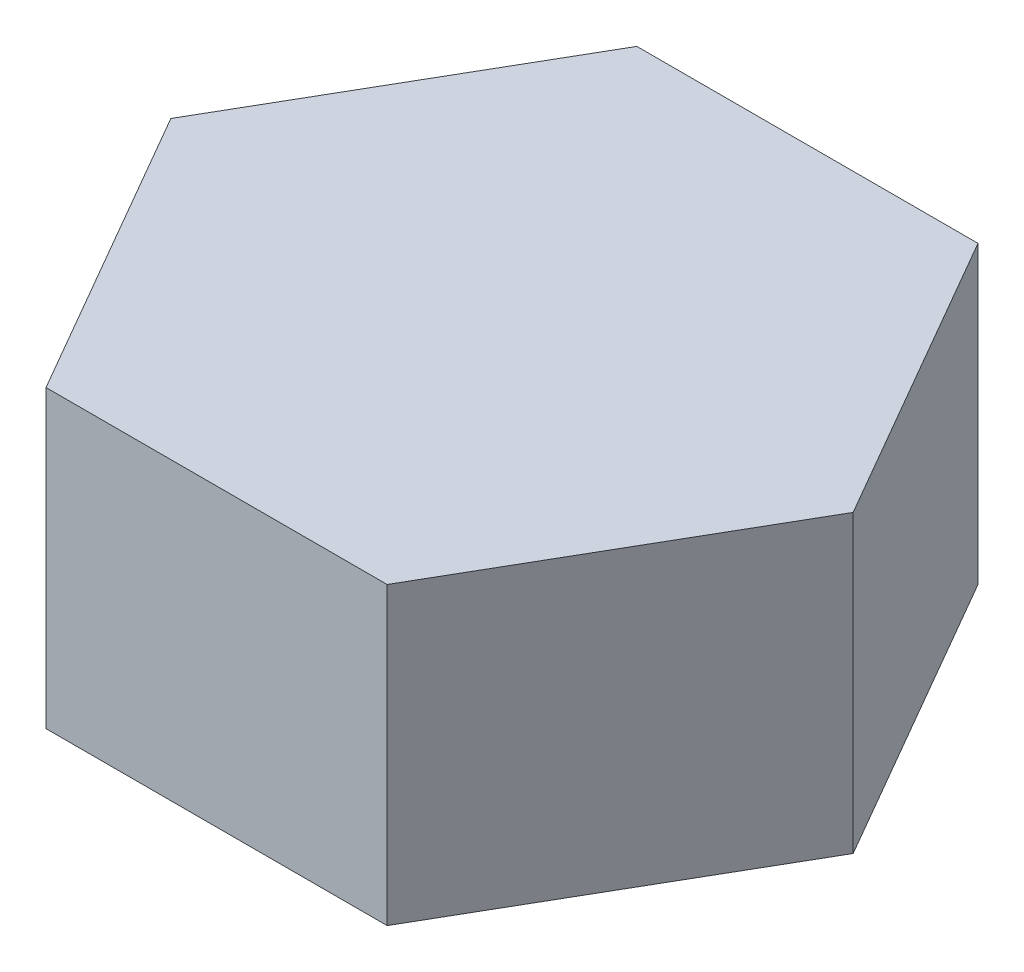
from build123d import *

# Parameters (mm, degrees)
BOSS_EXTRUDE1_DEPTH      = 3
BOSS_EXTRUDE1_DEPTH_BACK = 7


with BuildPart() as part:
    # Sketch1 → Boss-Extrude1 (new, two sides: drawn at the far end of the back side and taken through both)
    with BuildSketch(Plane(origin=(0, 0, 0), x_dir=(1, 0, 0), z_dir=(0, 1, 0)).offset(-BOSS_EXTRUDE1_DEPTH_BACK)):
        Polygon((-5.773502692, -10), (5.773502692, -10), (11.547005384, 0), (5.773502692, 10), (-5.773502692, 10), (-11.547005384, 0), align=None)
    extrude(amount=BOSS_EXTRUDE1_DEPTH + BOSS_EXTRUDE1_DEPTH_BACK)


solid = part.part
